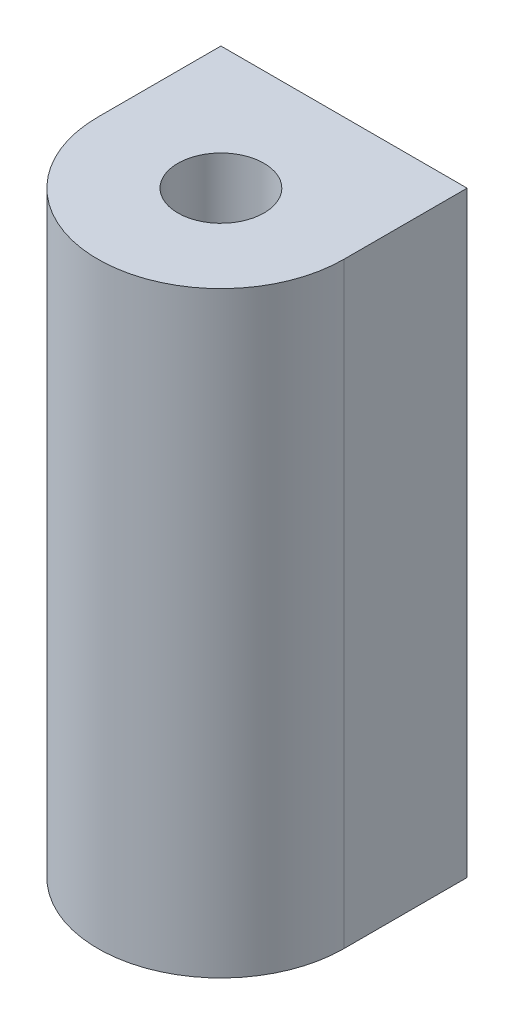
from build123d import *

# Parameters (mm, degrees)
SKETCH1_R           = 1.4
BOSS_EXTRUDE1_DEPTH = 19.4
SKETCH2_W           = 2.8
SKETCH2_H           = 7.8
BOSS_EXTRUDE2_DEPTH = 1.8


with BuildPart() as part:
    # Sketch1 → Boss-Extrude1 (new body)
    with BuildSketch(Plane(origin=(0, 0, 0), x_dir=(1, 0, 0), z_dir=(0, 1, 0))):
        with BuildLine():
            Line((-4, 0), (-4, 4))
            Line((-4, 4), (4, 4))
            Line((4, 4), (4, 0))
            ThreePointArc((4, 0), (0, -4), (-4, 0))
        make_face()
        with Locations(Location((0, 0, 0), (0, 0, 270))):
            Circle(SKETCH1_R, mode=Mode.SUBTRACT)
    extrude(amount=BOSS_EXTRUDE1_DEPTH)

    # Sketch2 → Boss-Extrude2 (add)
    with BuildSketch(Plane(origin=(0, 0, -4), x_dir=(-1, 0, 0), z_dir=(0, 0, -1))):
        with Locations((0, 13.15)):
            Rectangle(SKETCH2_W, SKETCH2_H)
    extrude(amount=BOSS_EXTRUDE2_DEPTH)


solid = part.part
